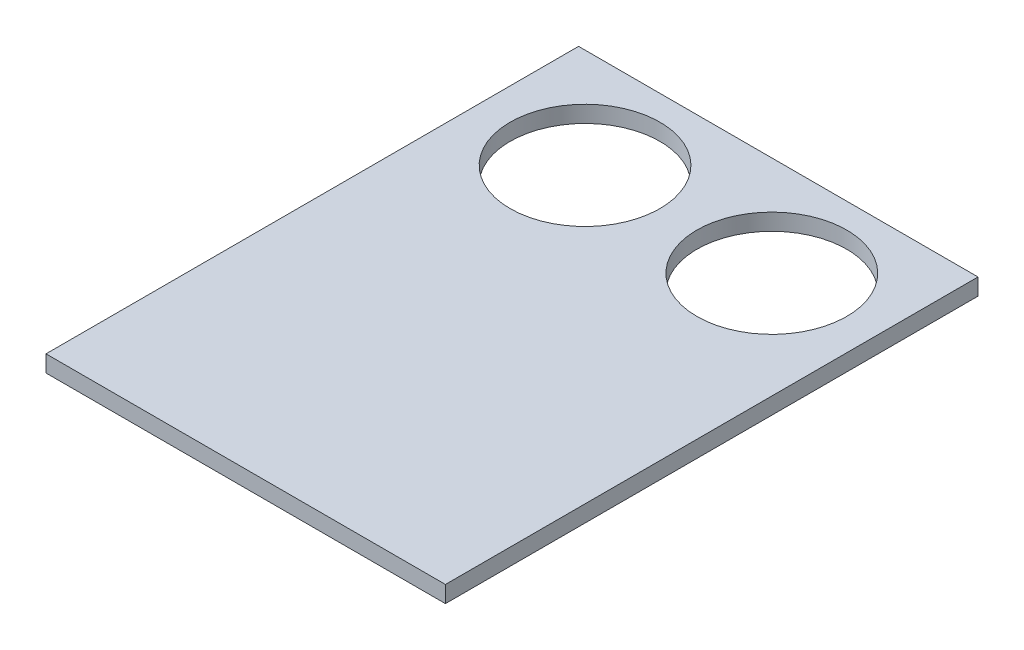
from build123d import *

# Parameters (mm, degrees)
SKETCH1_W           = 76.2
SKETCH1_H           = 101.6
BOSS_EXTRUDE1_DEPTH = 3.175
SKETCH2_R           = 14.2875
CUT_EXTRUDE1_DEPTH  = 28.575


with BuildPart() as part:
    # Sketch1 → Boss-Extrude1 (new body)
    with BuildSketch(Plane(origin=(0, 0, 0), x_dir=(1, 0, 0), z_dir=(0, 1, 0))):
        with Locations((38.1, -50.8)):
            Rectangle(SKETCH1_W, SKETCH1_H)
        Polygon((27.614248419, -19.05), (23.948074209, -12.7), (16.615725791, -12.7), (12.949551581, -19.05), (16.615725791, -25.4), (23.948074209, -25.4), align=None, mode=Mode.SUBTRACT)
        Polygon((55.9181, -11.717651581), (49.5681, -15.383825791), (49.5681, -22.716174209), (55.9181, -26.382348419), (62.2681, -22.716174209), (62.2681, -15.383825791), align=None, mode=Mode.SUBTRACT)
    extrude(amount=BOSS_EXTRUDE1_DEPTH)

    # Sketch2 → Cut-Extrude1 (cut)
    with BuildSketch(Plane(origin=(0, 3.175, 0), x_dir=(1, 0, 0), z_dir=(0, 1, 0))):
        with Locations(Location((20.2819, -19.05, 0), (0, 0, 270))):
            Circle(SKETCH2_R)
        with Locations(Location((55.9181, -19.05, 0), (0, 0, 270))):
            Circle(SKETCH2_R)
    extrude(amount=-CUT_EXTRUDE1_DEPTH, mode=Mode.SUBTRACT)


solid = part.part
